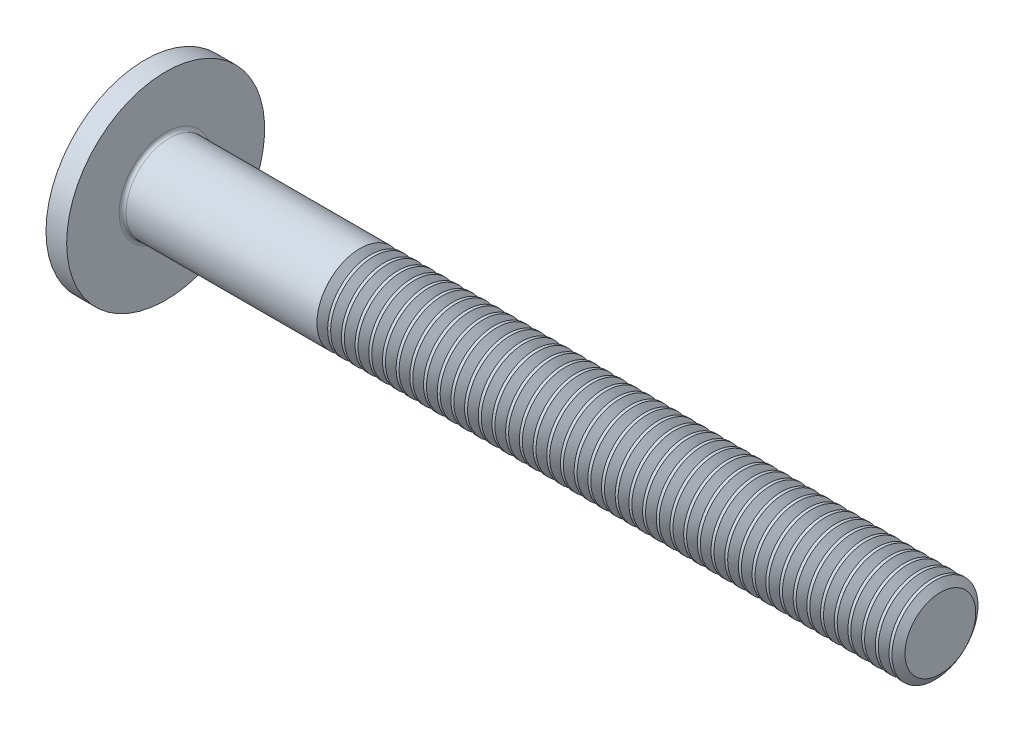
from build123d import *

# Parameters (mm, degrees)
FILLET1_R       = 0.2
RECPAT_COUNT    = 2
RECPAT_ANGLE    = 90
THDSCHPAT_COUNT = 43
THDSCHPAT_PITCH = 0.795238095


with BuildPart() as part:
    # BodySke → Base-Revolve (revolve)
    with BuildSketch(Plane.XY, mode=Mode.PRIVATE) as base_revolve_sk:
        Polygon((3.55, 2.5), (3.55, 5.75), (2.35, 5.75), (2.35, 0), (48.55, 0), (48.55, 2.5), align=None)
    revolve(base_revolve_sk.sketch.rotate(Axis((-6.35, 0, 0), (1, 0, 0)), 90), axis=Axis((-6.35, 0, 0), (1, 0, 0)))

    # Fillet1
    fillet1_edges = [part.edges().sort_by_distance(p)[0] for p in [
        (3.55, 0, -2.5),
    ]]
    fillet(fillet1_edges, radius=FILLET1_R)

    # PanSke → Pan (revolve)
    with BuildSketch(Plane.XY):
        with BuildLine():
            Line((2.35, 5.049504926), (2.35, 0))
            Line((2.35, 0), (0, 0))
            ThreePointArc((0, 0), (0.616272065, 2.784780063), (2.35, 5.049504926))
        make_face()
    revolve(axis=Axis((0, 0, 0), (1, 0, 0)))

    # Sketch3 → Recess section 0
    with BuildSketch(Plane(origin=(0, 0, 0), x_dir=(0, 0, -1), z_dir=(1, 0, 0))):
        with BuildLine():
            Line((-0.515, 2.35), (0.515, 2.35))
            Line((0.515, 2.35), (0.515, -2.35))
            Line((0.515, -2.35), (-0.515, -2.35))
            Line((-0.515, -2.35), (-0.515, 2.35))
        make_face()
    # Sketch4 → Recess section 1
    with BuildSketch(Plane(origin=(2.74, 0, 0), x_dir=(0, 0, -1), z_dir=(1, 0, 0))):
        with BuildLine():
            Line((-0.515, 2.106524682), (0.515, 2.106524682))
            Line((0.515, 2.106524682), (0.515, -2.106524682))
            Line((0.515, -2.106524682), (-0.515, -2.106524682))
            Line((-0.515, -2.106524682), (-0.515, 2.106524682))
        make_face()
    recess = loft(mode=Mode.SUBTRACT)

    # RecPat: Recess ×2 about axis
    recpat_axis = Axis((0, 0, 0), (1, 0, 0))
    for i in range(1, RECPAT_COUNT):
        add(recess.rotate(recpat_axis, i * RECPAT_ANGLE / (RECPAT_COUNT - 1)), mode=Mode.SUBTRACT)

    # RecCorSke → RecessCore (revolve, cut)
    with BuildSketch(Plane.XY, mode=Mode.PRIVATE) as recesscore_sk:
        Polygon((0, 0), (0, 1.172663335), (4.6, 0.851), (4.876506661, 0), align=None)
    revolve(recesscore_sk.sketch.rotate(Axis((-3.175, 0, 0), (1, 0, 0)), 90), axis=Axis((-3.175, 0, 0), (1, 0, 0)), mode=Mode.SUBTRACT)

    # ThdSchSke → ThreadSchematic (revolve, cut)
    with BuildSketch(Plane.XY, mode=Mode.PRIVATE) as threadschematic_sk:
        Polygon((15.15, -2.055), (14.838407645, -2.5), (14.838407645, -3.125), (15.461592355, -3.125), (15.461592355, -2.5), align=None)
    threadschematic = revolve(threadschematic_sk.sketch.rotate(Axis((-3.175, 0, 0), (1, 0, 0)), 270), axis=Axis((-3.175, 0, 0), (1, 0, 0)), mode=Mode.SUBTRACT)

    # ThdSchPat: ThreadSchematic ×43
    with Locations(*[(i * THDSCHPAT_PITCH, 0, 0) for i in range(1, THDSCHPAT_COUNT)]):
        add(threadschematic, mode=Mode.SUBTRACT)


solid = part.part
